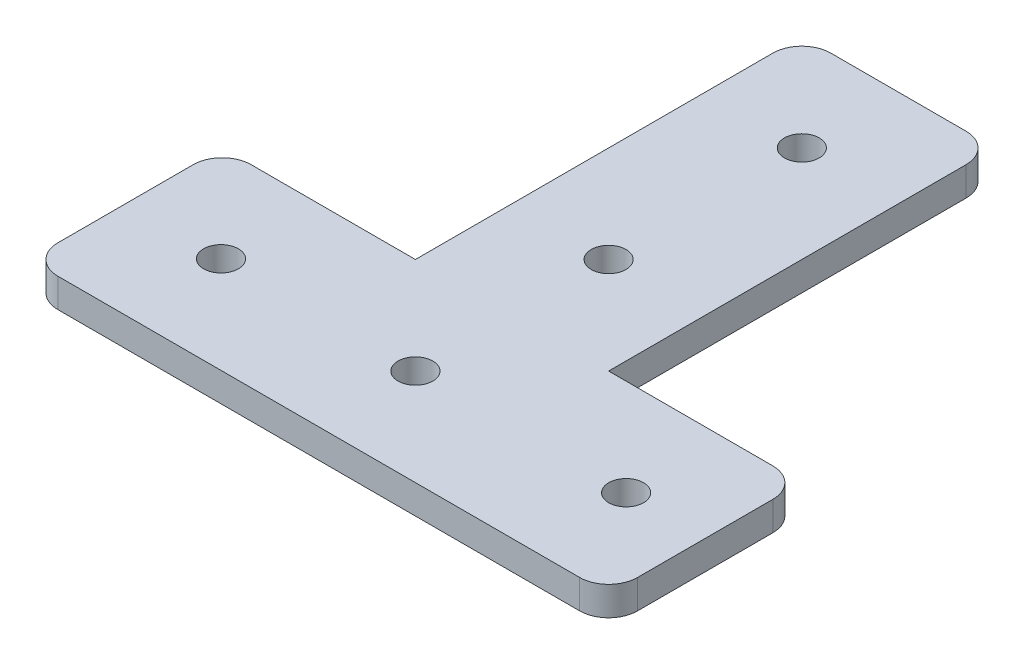
from build123d import *

# Parameters (mm, degrees)
SKETCH_2_W      = 20
SKETCH_2_H      = 40
SKETCH_2_R      = 1.8
SKETCH_2_W_2    = 60
SKETCH_2_H_2    = 20
EXTRUDE_1_DEPTH = 3
FILLET_1_R      = 3


with BuildPart() as part:
    # 草图2 → 凸台-拉伸1 (new body)
    # profile 1 of 2: a face of its own
    with BuildSketch(Plane(origin=(0, 0, 0), x_dir=(1, 0, 0), z_dir=(0, 1, 0))):
        with Locations((0, 30)):
            Rectangle(SKETCH_2_W, SKETCH_2_H)
        with Locations(Location((0, 20, 0), (0, 0, 270))):
            Circle(SKETCH_2_R, mode=Mode.SUBTRACT)
        with Locations(Location((0, 40, 0), (0, 0, 270))):
            Circle(SKETCH_2_R, mode=Mode.SUBTRACT)
    # profile 2 of 2: a face of its own
    with BuildSketch(Plane(origin=(0, 0, 0), x_dir=(1, 0, 0), z_dir=(0, 1, 0))):
        Rectangle(SKETCH_2_W_2, SKETCH_2_H_2)
        with Locations(Location((0, 0, 0), (0, 0, 270))):
            Circle(SKETCH_2_R, mode=Mode.SUBTRACT)
        with Locations(Location((-20.122806929, 0, 0), (0, 0, 270))):
            Circle(SKETCH_2_R, mode=Mode.SUBTRACT)
        with Locations(Location((21.812825763, 0, 0), (0, 0, 270))):
            Circle(SKETCH_2_R, mode=Mode.SUBTRACT)
    extrude(amount=EXTRUDE_1_DEPTH)

    # 圆角1
    fillet_1_edges = [part.edges().sort_by_distance(p)[0] for p in [
        (30, 1.5, -10),
        (30, 1.5, 10),
        (-30, 1.5, 10),
        (-30, 1.5, -10),
        (-10, 1.5, -50),
        (10, 1.5, -50),
    ]]
    fillet(fillet_1_edges, radius=FILLET_1_R)


solid = part.part
